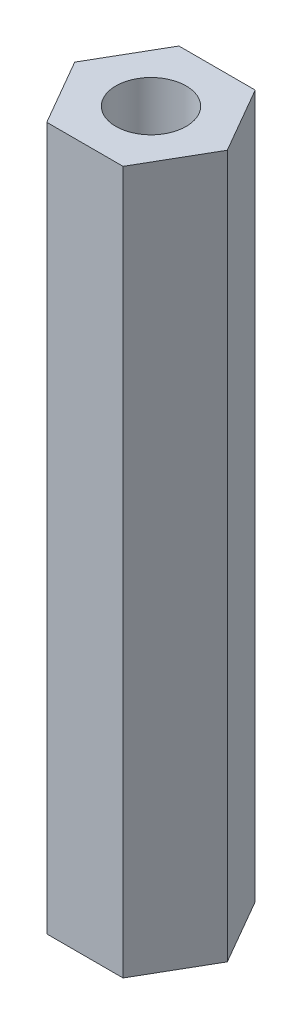
from build123d import *

# Parameters (mm, degrees)
BOSS_EXTRUDE1_DEPTH = 12.5
SKETCH3_R           = 1.25
CUT_EXTRUDE1_DEPTH  = 7


with BuildPart() as part:
    # Sketch1 → Boss-Extrude1 (new, symmetric)
    with BuildSketch(Plane(origin=(0, 0, 0), x_dir=(1, 0, 0), z_dir=(0, 1, 0))):
        Polygon((1.356773133, 2.35), (-1.356773133, 2.35), (-2.713546265, 0), (-1.356773133, -2.35), (1.356773133, -2.35), (2.713546265, 0), align=None)
    extrude(amount=BOSS_EXTRUDE1_DEPTH, both=True)

    # Sketch3 → Cut-Extrude1 (cut)
    with BuildSketch(Plane(origin=(0, 12.5, 0), x_dir=(1, 0, 0), z_dir=(0, 1, 0))):
        with Locations(Location((0, 0, 0), (0, 0, 270))):
            Circle(SKETCH3_R)
    cut_extrude1 = extrude(amount=-CUT_EXTRUDE1_DEPTH, mode=Mode.SUBTRACT)

    # Mirror1: Cut-Extrude1 across plane
    add(cut_extrude1.mirror(Plane.ZX), mode=Mode.SUBTRACT)


solid = part.part
